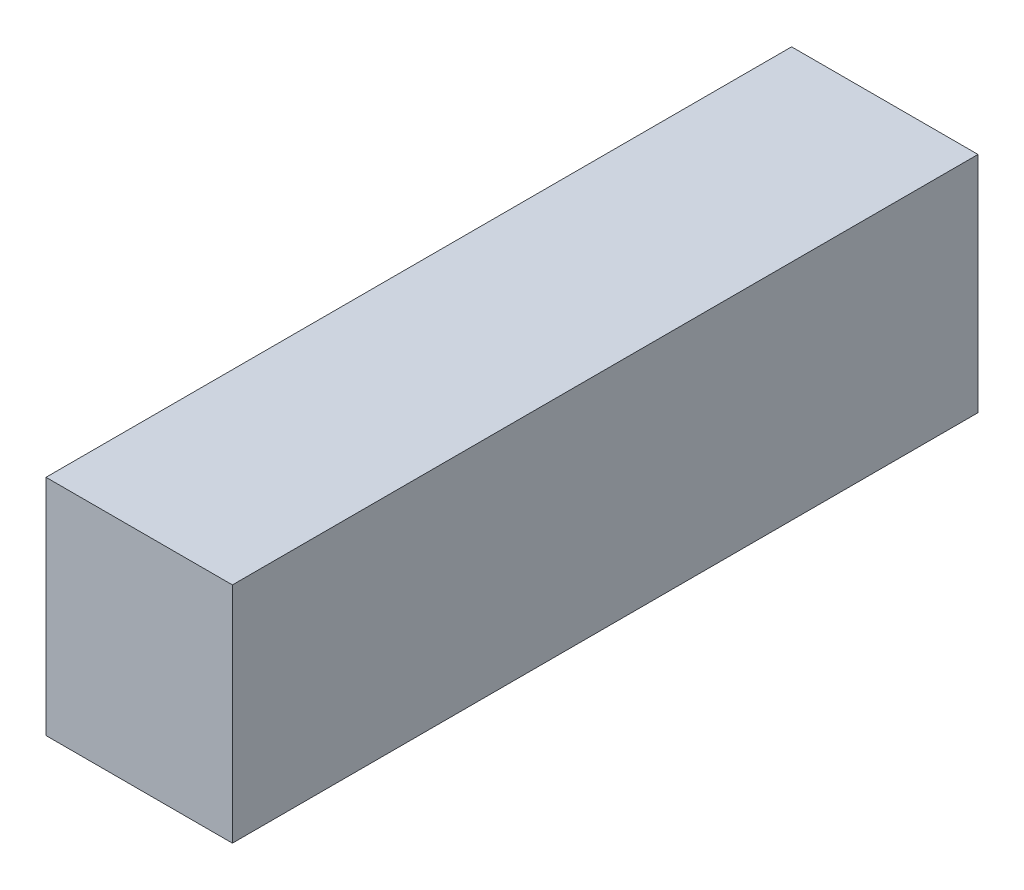
from build123d import *

# Parameters (mm, degrees)
SKETCH1_W           = 5
SKETCH1_H           = 6
BOSS_EXTRUDE1_DEPTH = 20


with BuildPart() as part:
    # Sketch1 → Boss-Extrude1 (new body)
    with BuildSketch(Plane.XY):
        Rectangle(SKETCH1_W, SKETCH1_H)
    extrude(amount=BOSS_EXTRUDE1_DEPTH)


solid = part.part
